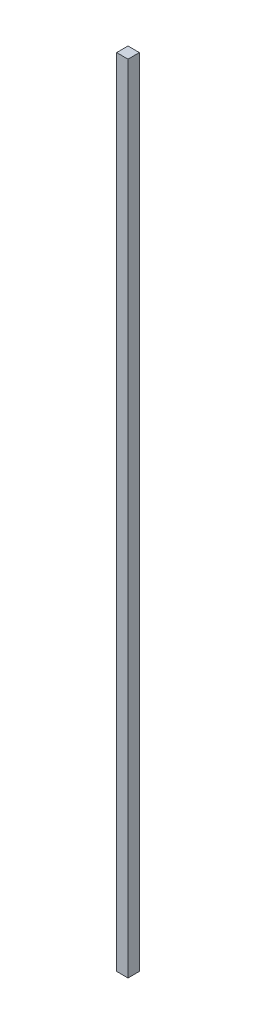
from build123d import *

# Parameters (mm, degrees)
SKETCH1_W           = 6
SKETCH1_H           = 6
BOSS_EXTRUDE1_DEPTH = 420


with BuildPart() as part:
    # Sketch1 → Boss-Extrude1 (new body)
    with BuildSketch(Plane(origin=(0, 0, 0), x_dir=(1, 0, 0), z_dir=(0, 1, 0))):
        Rectangle(SKETCH1_W, SKETCH1_H)
    extrude(amount=BOSS_EXTRUDE1_DEPTH)


solid = part.part
